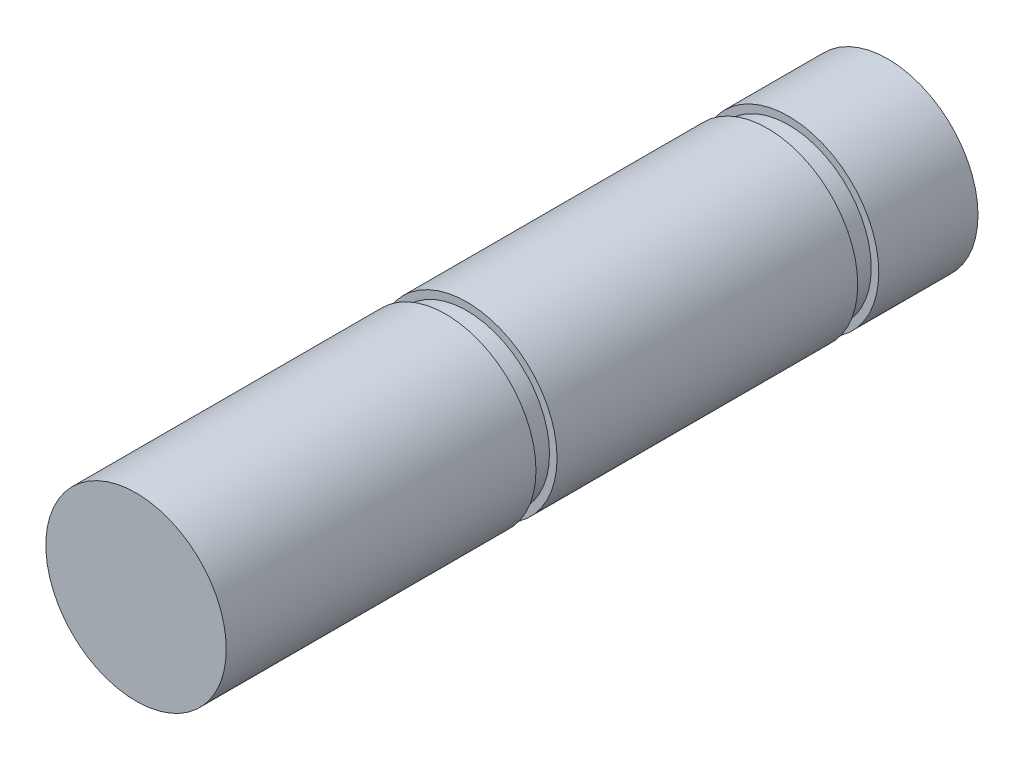
from build123d import *

# Parameters (mm, degrees)
SKETCH_1_R               = 3
EXTRUDE_1_DEPTH          = 25
CUT_EXTRUDE_1_DEPTH      = 0.35
CUT_EXTRUDE_1_DEPTH_BACK = 0.35
SKETCH_2_R               = 3
SKETCH_2_R_2             = 2.75
CUT_EXTRUDE_START        = -0.7
SKETCH_3_R               = 3
SKETCH_3_R_2             = 2.75
CUT_EXTRUDE_2_DEPTH      = 0.7


with BuildPart() as part:
    # 스케치1 → 보스-돌출1 (new body)
    with BuildSketch(Plane.XY):
        Circle(SKETCH_1_R)
    extrude(amount=EXTRUDE_1_DEPTH)

    # 스케치2 → 컷-돌출1 (cut, two sides: drawn at the far end of the back side and taken through both)
    with BuildSketch(Plane.XY.offset(3.65).offset(-CUT_EXTRUDE_1_DEPTH_BACK)):
        Circle(SKETCH_2_R)
        Circle(SKETCH_2_R_2, mode=Mode.SUBTRACT)
    extrude(amount=CUT_EXTRUDE_1_DEPTH + CUT_EXTRUDE_1_DEPTH_BACK, mode=Mode.SUBTRACT)

    # 스케치3 → 컷-돌출2 (cut)
    with BuildSketch(Plane.XY.offset(14.7).offset(CUT_EXTRUDE_START)):
        Circle(SKETCH_3_R)
        Circle(SKETCH_3_R_2, mode=Mode.SUBTRACT)
    extrude(amount=CUT_EXTRUDE_2_DEPTH, mode=Mode.SUBTRACT)


solid = part.part
